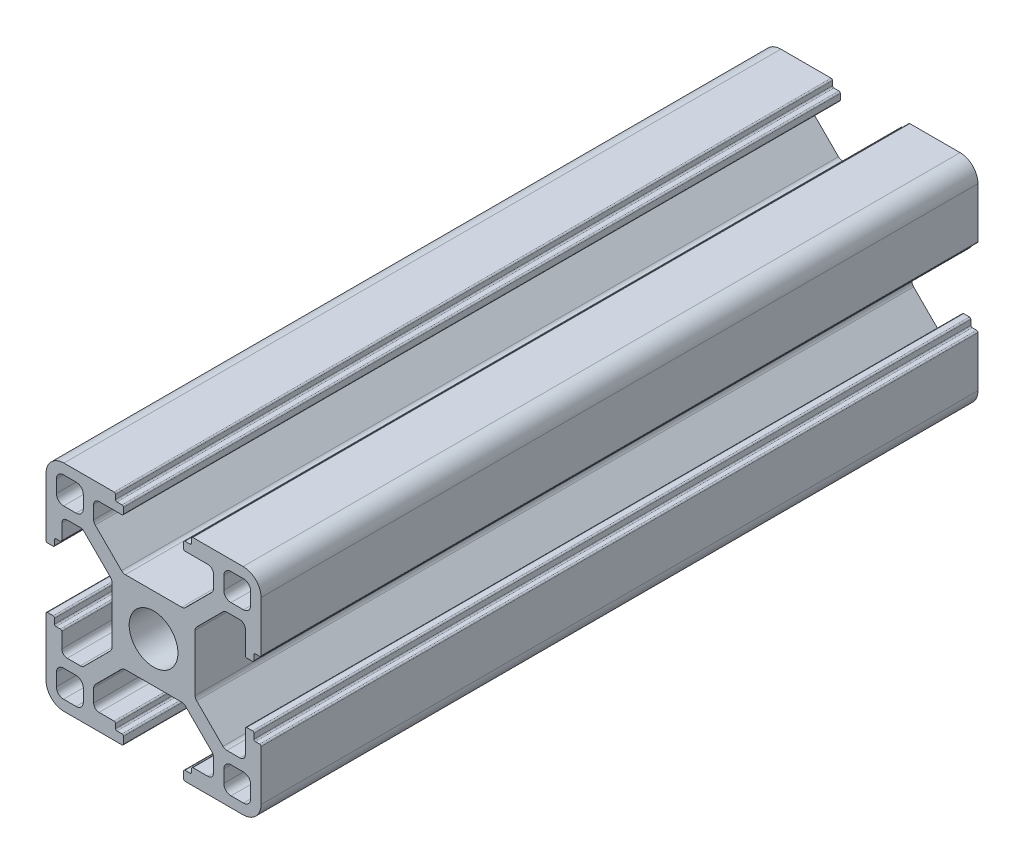
from build123d import *

# Parameters (mm, degrees)
SKETCH1_R           = 3.4
BOSS_EXTRUDE1_DEPTH = 100


with BuildPart() as part:
    # Sketch1 → Boss-Extrude1 (new body)
    with BuildSketch(Plane.XY):
        with BuildLine():
            Line((0, 2.5), (0, 10.6))
            ThreePointArc((0, 10.6), (0.058578644, 10.741421356), (0.2, 10.8))
            Line((0.2, 10.8), (1, 10.8))
            ThreePointArc((1, 10.8), (1.141421356, 10.741421356), (1.2, 10.6))
            Line((1.2, 10.6), (1.2, 9.9))
            ThreePointArc((1.2, 9.9), (1.258578644, 9.758578644), (1.4, 9.7))
            Line((1.4, 9.7), (2, 9.7))
            ThreePointArc((2, 9.7), (2.141421356, 9.641421356), (2.2, 9.5))
            Line((2.2, 9.5), (2.2, 7.4))
            ThreePointArc((2.2, 7.4), (2.419669914, 6.869669914), (2.95, 6.65))
            Line((2.95, 6.65), (4.78370491, 6.65))
            ThreePointArc((4.78370491, 6.65), (5.070717484, 6.707090351), (5.314034995, 6.869669914))
            Line((5.314034995, 6.869669914), (8.980330086, 10.535965005))
            ThreePointArc((8.980330086, 10.535965005), (9.142909649, 10.779282516), (9.2, 11.06629509))
            Line((9.2, 11.06629509), (9.2, 18.93370491))
            ThreePointArc((9.2, 18.93370491), (9.142909649, 19.220717484), (8.980330086, 19.464034995))
            Line((8.980330086, 19.464034995), (5.314034995, 23.130330086))
            ThreePointArc((5.314034995, 23.130330086), (5.070717484, 23.292909649), (4.78370491, 23.35))
            Line((4.78370491, 23.35), (2.95, 23.35))
            ThreePointArc((2.95, 23.35), (2.419669914, 23.130330086), (2.2, 22.6))
            Line((2.2, 22.6), (2.2, 20.5))
            ThreePointArc((2.2, 20.5), (2.141421356, 20.358578644), (2, 20.3))
            Line((2, 20.3), (1.4, 20.3))
            ThreePointArc((1.4, 20.3), (1.258578644, 20.241421356), (1.2, 20.1))
            Line((1.2, 20.1), (1.2, 19.4))
            ThreePointArc((1.2, 19.4), (1.141421356, 19.258578644), (1, 19.2))
            Line((1, 19.2), (0.2, 19.2))
            ThreePointArc((0.2, 19.2), (0.058578644, 19.258578644), (0, 19.4))
            Line((0, 19.4), (0, 27.5))
            ThreePointArc((0, 27.5), (0.732233047, 29.267766953), (2.5, 30))
            Line((2.5, 30), (9.5, 30))
            ThreePointArc((9.5, 30), (9.641421356, 29.941421356), (9.7, 29.8))
            Line((9.7, 29.8), (9.7, 29.2))
            ThreePointArc((9.7, 29.2), (9.758578644, 29.058578644), (9.9, 29))
            Line((9.9, 29), (10.6, 29))
            ThreePointArc((10.6, 29), (10.741421356, 28.941421356), (10.8, 28.8))
            Line((10.8, 28.8), (10.8, 28))
            ThreePointArc((10.8, 28), (10.741421356, 27.858578644), (10.6, 27.8))
            Line((10.6, 27.8), (7.4, 27.8))
            ThreePointArc((7.4, 27.8), (6.869669914, 27.580330086), (6.65, 27.05))
            Line((6.65, 27.05), (6.65, 25.21629509))
            ThreePointArc((6.65, 25.21629509), (6.707090351, 24.929282516), (6.869669914, 24.685965005))
            Line((6.869669914, 24.685965005), (10.535965005, 21.019669914))
            ThreePointArc((10.535965005, 21.019669914), (10.779282516, 20.857090351), (11.06629509, 20.8))
            Line((11.06629509, 20.8), (18.93370491, 20.8))
            ThreePointArc((18.93370491, 20.8), (19.220717484, 20.857090351), (19.464034995, 21.019669914))
            Line((19.464034995, 21.019669914), (23.130330086, 24.685965005))
            ThreePointArc((23.130330086, 24.685965005), (23.292909649, 24.929282516), (23.35, 25.21629509))
            Line((23.35, 25.21629509), (23.35, 27.05))
            ThreePointArc((23.35, 27.05), (23.130330086, 27.580330086), (22.6, 27.8))
            Line((22.6, 27.8), (19.4, 27.8))
            ThreePointArc((19.4, 27.8), (19.258578644, 27.858578644), (19.2, 28))
            Line((19.2, 28), (19.2, 28.8))
            ThreePointArc((19.2, 28.8), (19.258578644, 28.941421356), (19.4, 29))
            Line((19.4, 29), (20.1, 29))
            ThreePointArc((20.1, 29), (20.241421356, 29.058578644), (20.3, 29.2))
            Line((20.3, 29.2), (20.3, 29.8))
            ThreePointArc((20.3, 29.8), (20.358578644, 29.941421356), (20.5, 30))
            Line((20.5, 30), (27.5, 30))
            ThreePointArc((27.5, 30), (29.267766953, 29.267766953), (30, 27.5))
            Line((30, 27.5), (30, 20.5))
            ThreePointArc((30, 20.5), (29.941421356, 20.358578644), (29.8, 20.3))
            Line((29.8, 20.3), (29.2, 20.3))
            ThreePointArc((29.2, 20.3), (29.058578644, 20.241421356), (29, 20.1))
            Line((29, 20.1), (29, 19.4))
            ThreePointArc((29, 19.4), (28.941421356, 19.258578644), (28.8, 19.2))
            Line((28.8, 19.2), (28, 19.2))
            ThreePointArc((28, 19.2), (27.858578644, 19.258578644), (27.8, 19.4))
            Line((27.8, 19.4), (27.8, 22.6))
            ThreePointArc((27.8, 22.6), (27.580330086, 23.130330086), (27.05, 23.35))
            Line((27.05, 23.35), (25.21629509, 23.35))
            ThreePointArc((25.21629509, 23.35), (24.929282516, 23.292909649), (24.685965005, 23.130330086))
            Line((24.685965005, 23.130330086), (21.019669914, 19.464034995))
            ThreePointArc((21.019669914, 19.464034995), (20.857090351, 19.220717484), (20.8, 18.93370491))
            Line((20.8, 18.93370491), (20.8, 11.06629509))
            ThreePointArc((20.8, 11.06629509), (20.857090351, 10.779282516), (21.019669914, 10.535965005))
            Line((21.019669914, 10.535965005), (24.685965005, 6.869669914))
            ThreePointArc((24.685965005, 6.869669914), (24.929282516, 6.707090351), (25.21629509, 6.65))
            Line((25.21629509, 6.65), (27.05, 6.65))
            ThreePointArc((27.05, 6.65), (27.580330086, 6.869669914), (27.8, 7.4))
            Line((27.8, 7.4), (27.8, 10.6))
            ThreePointArc((27.8, 10.6), (27.858578644, 10.741421356), (28, 10.8))
            Line((28, 10.8), (28.8, 10.8))
            ThreePointArc((28.8, 10.8), (28.941421356, 10.741421356), (29, 10.6))
            Line((29, 10.6), (29, 9.9))
            ThreePointArc((29, 9.9), (29.058578644, 9.758578644), (29.2, 9.7))
            Line((29.2, 9.7), (29.8, 9.7))
            ThreePointArc((29.8, 9.7), (29.941421356, 9.641421356), (30, 9.5))
            Line((30, 9.5), (30, 2.5))
            ThreePointArc((30, 2.5), (29.267766953, 0.732233047), (27.5, 0))
            Line((27.5, 0), (19.4, 0))
            ThreePointArc((19.4, 0), (19.258578644, 0.058578644), (19.2, 0.2))
            Line((19.2, 0.2), (19.2, 1.132430858))
            ThreePointArc((19.2, 1.132430858), (19.258578644, 1.273852214), (19.4, 1.332430858))
            Line((19.4, 1.332430858), (20.1, 1.332430858))
            ThreePointArc((20.1, 1.332430858), (20.241421356, 1.391009502), (20.3, 1.532430858))
            Line((20.3, 1.532430858), (20.3, 2))
            ThreePointArc((20.3, 2), (20.358578644, 2.141421356), (20.5, 2.2))
            Line((20.5, 2.2), (22.6, 2.2))
            ThreePointArc((22.6, 2.2), (23.130330086, 2.419669914), (23.35, 2.95))
            Line((23.35, 2.95), (23.35, 4.916135768))
            ThreePointArc((23.35, 4.916135768), (23.292909649, 5.203148342), (23.130330086, 5.446465854))
            Line((23.130330086, 5.446465854), (19.464034995, 9.112760944))
            ThreePointArc((19.464034995, 9.112760944), (19.220717484, 9.275340508), (18.93370491, 9.332430858))
            Line((18.93370491, 9.332430858), (11.06629509, 9.332430858))
            ThreePointArc((11.06629509, 9.332430858), (10.779282516, 9.275340508), (10.535965005, 9.112760944))
            Line((10.535965005, 9.112760944), (6.869669914, 5.446465854))
            ThreePointArc((6.869669914, 5.446465854), (6.707090351, 5.203148342), (6.65, 4.916135768))
            Line((6.65, 4.916135768), (6.65, 3.082430858))
            ThreePointArc((6.65, 3.082430858), (6.869669914, 2.552100772), (7.4, 2.332430858))
            Line((7.4, 2.332430858), (9.5, 2.332430858))
            ThreePointArc((9.5, 2.332430858), (9.641421356, 2.273852214), (9.7, 2.132430858))
            Line((9.7, 2.132430858), (9.7, 1.532430858))
            ThreePointArc((9.7, 1.532430858), (9.758578644, 1.391009502), (9.9, 1.332430858))
            Line((9.9, 1.332430858), (10.6, 1.332430858))
            ThreePointArc((10.6, 1.332430858), (10.741421356, 1.273852214), (10.8, 1.132430858))
            Line((10.8, 1.132430858), (10.8, 0.2))
            ThreePointArc((10.8, 0.2), (10.741421356, 0.058578644), (10.6, 0))
            Line((10.6, 0), (2.5, 0))
            ThreePointArc((2.5, 0), (0.732233047, 0.732233047), (0, 2.5))
        make_face()
        with Locations((15, 15)):
            Circle(SKETCH1_R, mode=Mode.SUBTRACT)
        with BuildLine():
            Line((27.55, 1.45), (25.8, 1.45))
            ThreePointArc((25.8, 1.45), (25.092893219, 1.742893219), (24.8, 2.45))
            Line((24.8, 2.45), (24.8, 4.2))
            ThreePointArc((24.8, 4.2), (25.092893219, 4.907106781), (25.8, 5.2))
            Line((25.8, 5.2), (27.55, 5.2))
            ThreePointArc((27.55, 5.2), (28.257106781, 4.907106781), (28.55, 4.2))
            Line((28.55, 4.2), (28.55, 2.45))
            ThreePointArc((28.55, 2.45), (28.257106781, 1.742893219), (27.55, 1.45))
        make_face(mode=Mode.SUBTRACT)
        with BuildLine():
            Line((24.8, 25.8), (24.8, 27.55))
            ThreePointArc((24.8, 27.55), (25.092893219, 28.257106781), (25.8, 28.55))
            Line((25.8, 28.55), (27.55, 28.55))
            ThreePointArc((27.55, 28.55), (28.257106781, 28.257106781), (28.55, 27.55))
            Line((28.55, 27.55), (28.55, 25.8))
            ThreePointArc((28.55, 25.8), (28.257106781, 25.092893219), (27.55, 24.8))
            Line((27.55, 24.8), (25.8, 24.8))
            ThreePointArc((25.8, 24.8), (25.092893219, 25.092893219), (24.8, 25.8))
        make_face(mode=Mode.SUBTRACT)
        with BuildLine():
            Line((2.45, 28.55), (4.2, 28.55))
            ThreePointArc((4.2, 28.55), (4.907106781, 28.257106781), (5.2, 27.55))
            Line((5.2, 27.55), (5.2, 25.8))
            ThreePointArc((5.2, 25.8), (4.907106781, 25.092893219), (4.2, 24.8))
            Line((4.2, 24.8), (2.45, 24.8))
            ThreePointArc((2.45, 24.8), (1.742893219, 25.092893219), (1.45, 25.8))
            Line((1.45, 25.8), (1.45, 27.55))
            ThreePointArc((1.45, 27.55), (1.742893219, 28.257106781), (2.45, 28.55))
        make_face(mode=Mode.SUBTRACT)
        with BuildLine():
            Line((1.45, 2.45), (1.45, 4.2))
            ThreePointArc((1.45, 4.2), (1.742893219, 4.907106781), (2.45, 5.2))
            Line((2.45, 5.2), (4.2, 5.2))
            ThreePointArc((4.2, 5.2), (4.907106781, 4.907106781), (5.2, 4.2))
            Line((5.2, 4.2), (5.2, 2.45))
            ThreePointArc((5.2, 2.45), (4.907106781, 1.742893219), (4.2, 1.45))
            Line((4.2, 1.45), (2.45, 1.45))
            ThreePointArc((2.45, 1.45), (1.742893219, 1.742893219), (1.45, 2.45))
        make_face(mode=Mode.SUBTRACT)
    extrude(amount=BOSS_EXTRUDE1_DEPTH)


solid = part.part
